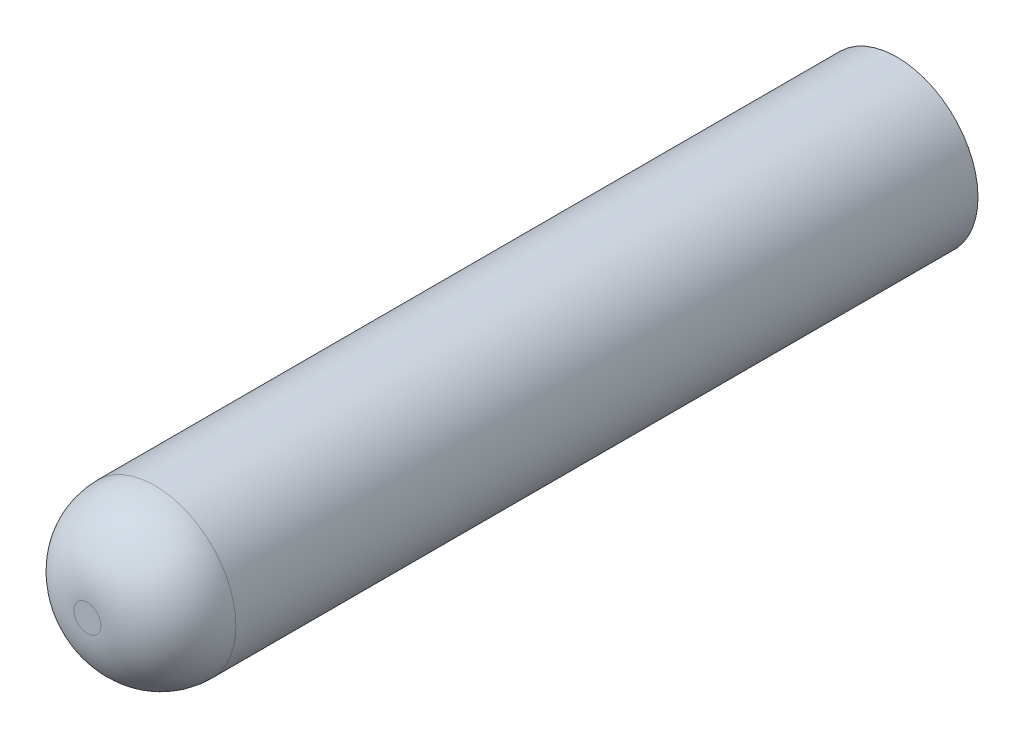
from build123d import *

# Parameters (mm, degrees)
SKETCH1_R           = 6
BOSS_EXTRUDE1_DEPTH = 60
FILLET1_R           = 5


with BuildPart() as part:
    # Sketch1 → Boss-Extrude1 (new body)
    with BuildSketch(Plane.XY):
        Circle(SKETCH1_R)
    extrude(amount=BOSS_EXTRUDE1_DEPTH)

    # Fillet1
    fillet1_edges = [part.edges().sort_by_distance(p)[0] for p in [
        (-6, 0, 60),
    ]]
    fillet(fillet1_edges, radius=FILLET1_R)


solid = part.part
